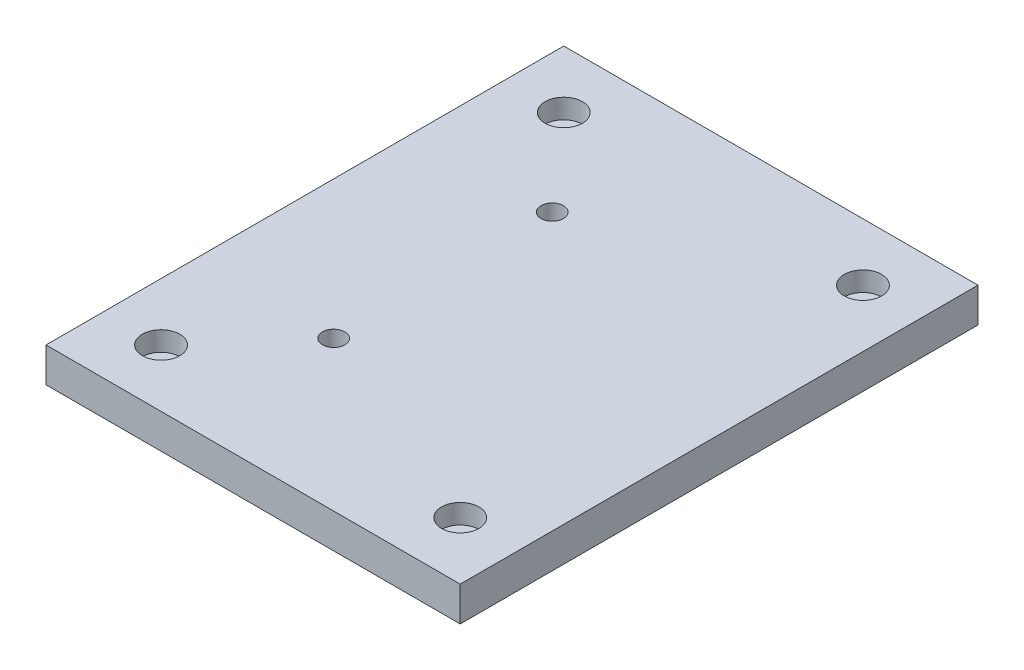
from build123d import *

# Parameters (mm, degrees)
SZKIC1_W                                            = 72
SZKIC1_H                                            = 90
DODANIE_WYCI_GNI_CIE1_DEPTH                         = 6
CBORE_FOR_M3_HEX_SOCKET_HEAD_CAP_SCREW1_D           = 3.2
CBORE_FOR_M3_HEX_SOCKET_HEAD_CAP_SCREW1_DEPTH       = 7.7
CBORE_FOR_M3_HEX_SOCKET_HEAD_CAP_SCREW1_CBORE_D     = 6.5
CBORE_FOR_M3_HEX_SOCKET_HEAD_CAP_SCREW1_CBORE_DEPTH = 3.4
CBORE_FOR_M3_HEX_SOCKET_HEAD_CAP_SCREW1_TIP         = 0.96137699
F_1_0MM_DOWEL_HOLE1_D                               = 3.9


with BuildPart() as part:
    # Szkic1 → Dodanie-wyciągnięcie1 (new body)
    with BuildSketch(Plane(origin=(0, 0, 0), x_dir=(1, 0, 0), z_dir=(0, 1, 0))):
        Rectangle(SZKIC1_W, SZKIC1_H)
    extrude(amount=DODANIE_WYCI_GNI_CIE1_DEPTH)

    # CBORE for M3 Hex Socket Head Cap Screw1
    with Locations(Plane(origin=(0, 6, 0), x_dir=(1, 0, 0), z_dir=(0, 1, 0))):
        with Locations((-26, 35), (26, 35), (26, -35), (-26, -35)):
            CounterBoreHole(CBORE_FOR_M3_HEX_SOCKET_HEAD_CAP_SCREW1_D / 2, CBORE_FOR_M3_HEX_SOCKET_HEAD_CAP_SCREW1_CBORE_D / 2, CBORE_FOR_M3_HEX_SOCKET_HEAD_CAP_SCREW1_CBORE_DEPTH, depth=CBORE_FOR_M3_HEX_SOCKET_HEAD_CAP_SCREW1_DEPTH)
            with Locations((0, 0, -(CBORE_FOR_M3_HEX_SOCKET_HEAD_CAP_SCREW1_DEPTH + CBORE_FOR_M3_HEX_SOCKET_HEAD_CAP_SCREW1_TIP / 2))):  # 118° drill point
                Cone(0, CBORE_FOR_M3_HEX_SOCKET_HEAD_CAP_SCREW1_D / 2, CBORE_FOR_M3_HEX_SOCKET_HEAD_CAP_SCREW1_TIP, mode=Mode.SUBTRACT)

    # Ø1.0mm Dowel Hole1 (through all)
    with Locations(Plane(origin=(0, 6, 0), x_dir=(1, 0, 0), z_dir=(0, 1, 0))):
        with Locations((-12, -19), (-12, 19)):
            Hole(F_1_0MM_DOWEL_HOLE1_D / 2)


solid = part.part
